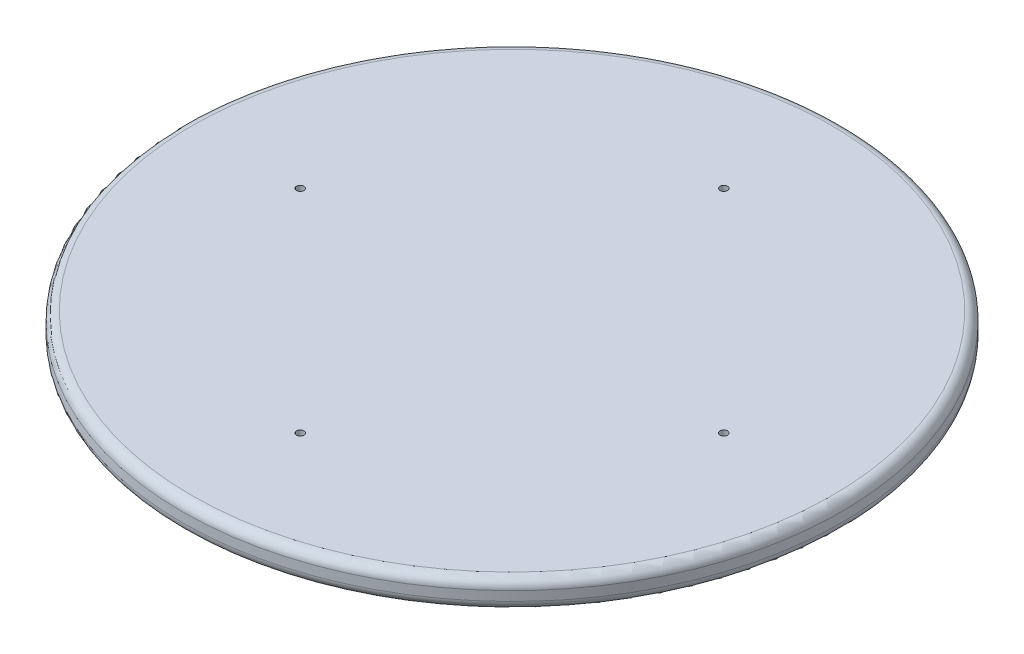
from build123d import *

# Parameters (mm, degrees)
SKETCH1_R           = 350
BOSS_EXTRUDE1_DEPTH = 30
FILLET1_R           = 10
SKETCH2_R           = 4
CUT_EXTRUDE1_DEPTH  = 48


with BuildPart() as part:
    # Sketch1 → Boss-Extrude1 (new body)
    with BuildSketch(Plane(origin=(0, 0, 0), x_dir=(1, 0, 0), z_dir=(0, 1, 0))):
        with Locations(Location((0, 0, 0), (0, 0, 270))):
            Circle(SKETCH1_R)
    extrude(amount=BOSS_EXTRUDE1_DEPTH)

    # Fillet1
    fillet1_edges = [part.edges().sort_by_distance(p)[0] for p in [
        (0, 0, -350),
        (0, 30, -350),
    ]]
    fillet(fillet1_edges, radius=FILLET1_R)

    # Sketch2 → Cut-Extrude1 (cut, symmetric)
    with BuildSketch(Plane(origin=(0, 30, 0), x_dir=(1, 0, 0), z_dir=(0, 1, 0))):
        with Locations(Location((0, 225, 0), (0, 0, 270))):
            Circle(SKETCH2_R)
        with Locations(Location((225, 0, 0), (0, 0, 270))):
            Circle(SKETCH2_R)
        with Locations(Location((0, -225, 0), (0, 0, 270))):
            Circle(SKETCH2_R)
        with Locations(Location((-225, 0, 0), (0, 0, 270))):
            Circle(SKETCH2_R)
    extrude(amount=CUT_EXTRUDE1_DEPTH, both=True, mode=Mode.SUBTRACT)


solid = part.part
